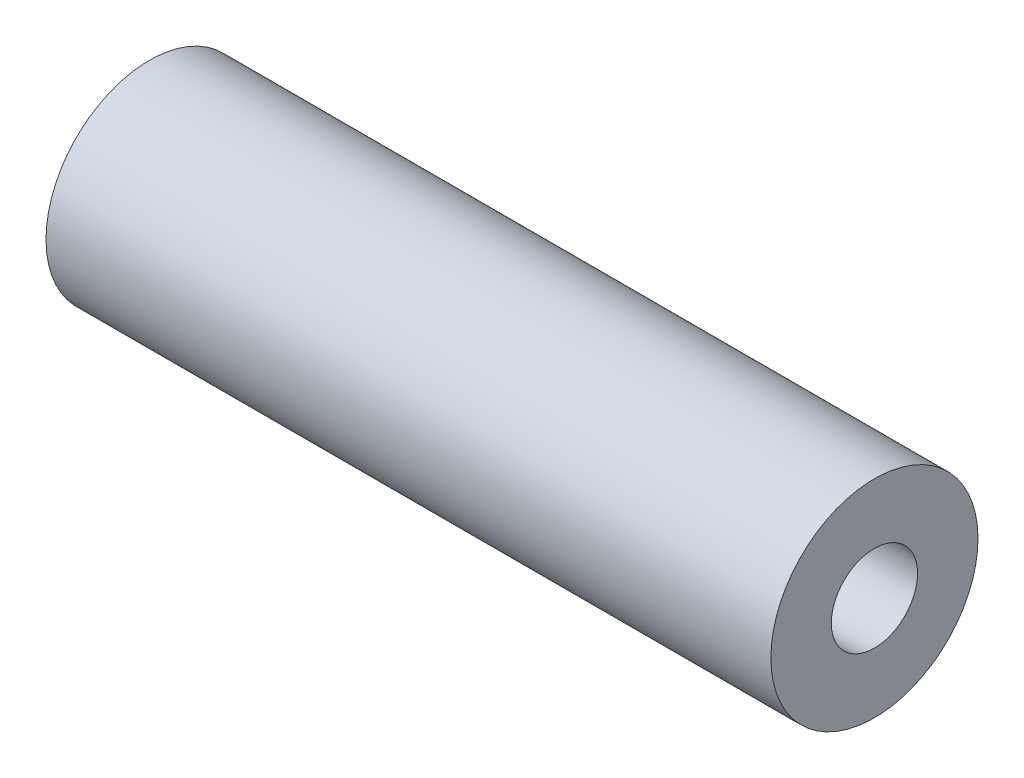
from build123d import *

# Parameters (mm, degrees)
SKETCH1_R           = 3
BOSS_EXTRUDE1_DEPTH = 21
SKETCH2_R           = 1.25
CUT_EXTRUDE1_DEPTH  = 21


with BuildPart() as part:
    # Sketch1 → Boss-Extrude1 (new body)
    with BuildSketch(Plane(origin=(0, 0, 0), x_dir=(0, 0, -1), z_dir=(1, 0, 0))):
        with Locations(Location((0, 0, 0), (0, 0, 180))):
            Circle(SKETCH1_R)
    extrude(amount=BOSS_EXTRUDE1_DEPTH)

    # Sketch2 → Cut-Extrude1 (cut)
    with BuildSketch(Plane.ZY):
        Circle(SKETCH2_R)
    extrude(amount=-CUT_EXTRUDE1_DEPTH, mode=Mode.SUBTRACT)


solid = part.part
